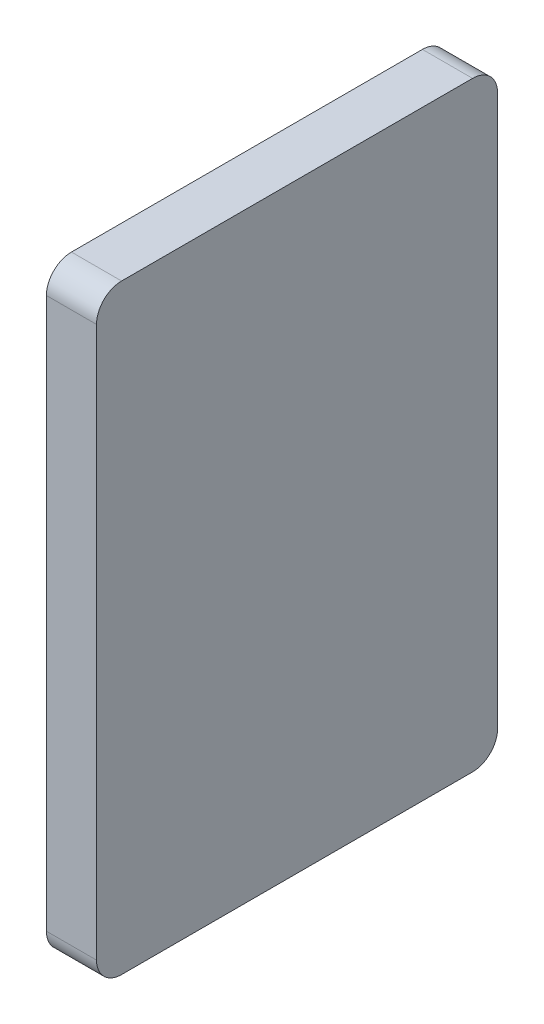
from build123d import *

# Parameters (mm, degrees)
BOSS_EXTRUDE1_START = 117.777002
SKETCH1_W           = 50.8
SKETCH1_H           = 76.073
BOSS_EXTRUDE1_DEPTH = 6.35
FILLET1_R           = 3.175


with BuildPart() as part:
    # Sketch1 → Boss-Extrude1 (new body)
    with BuildSketch(Plane(origin=(0, 0, 0), x_dir=(0, 0, -1), z_dir=(1, 0, 0)).offset(BOSS_EXTRUDE1_START)):
        with Locations((-1082.412834154, 119.568074554)):
            Rectangle(SKETCH1_W, SKETCH1_H)
    extrude(amount=BOSS_EXTRUDE1_DEPTH)

    # Fillet1
    fillet1_edges = [part.edges().sort_by_distance(p)[0] for p in [
        (120.952002, 81.531574554, 1057.012834154),
        (120.952002, 81.531574554, 1107.812834154),
        (120.952002, 157.604574554, 1107.812834154),
        (120.952002, 157.604574554, 1057.012834154),
    ]]
    fillet(fillet1_edges, radius=FILLET1_R)


solid = part.part
